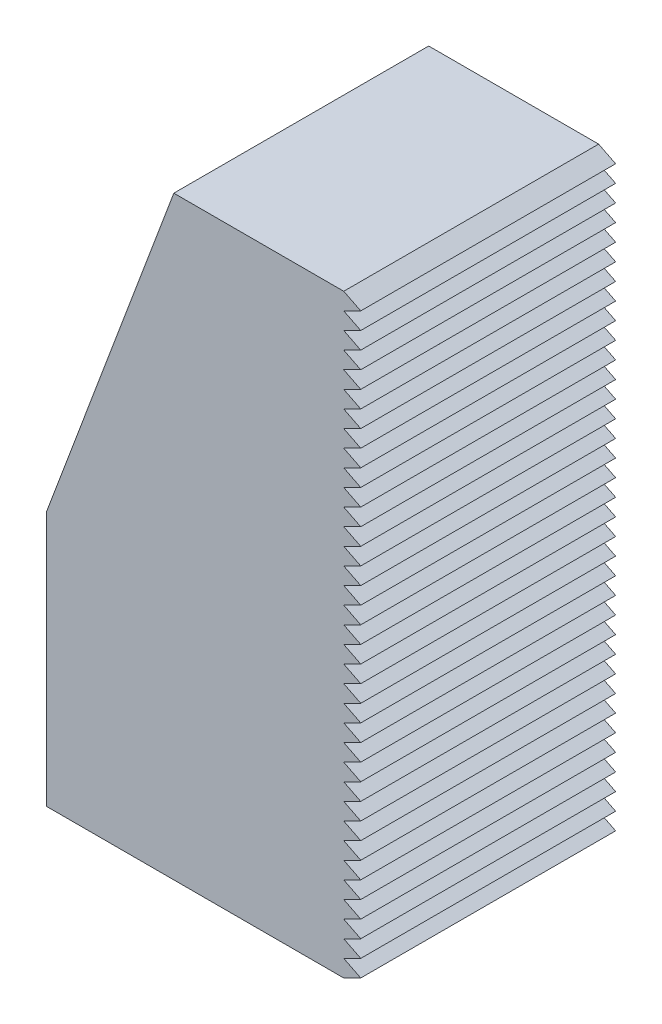
from build123d import *

# Parameters (mm, degrees)
BOSS_EXTRUDE1_DEPTH = 30
BOSS_EXTRUDE3_DEPTH = 30
LPATTERN1_COUNT     = 35
LPATTERN1_PITCH     = 2


with BuildPart() as part:
    # Sketch2 → Boss-Extrude1 (new body)
    with BuildSketch(Plane.XY):
        Polygon((-35, 30), (-20, 70), (0, 70), (0, 0), (-35, 0), align=None)
    extrude(amount=BOSS_EXTRUDE1_DEPTH)

    # Sketch3 → Boss-Extrude3 (add)
    with BuildSketch(Plane.XY.offset(30)):
        Polygon((0, 70), (2, 69), (0, 68), align=None)
    boss_extrude3 = extrude(amount=-BOSS_EXTRUDE3_DEPTH)

    # LPattern1: Boss-Extrude3 ×35
    with Locations(*[(0, -i * LPATTERN1_PITCH, 0) for i in range(1, LPATTERN1_COUNT)]):
        add(boss_extrude3)


solid = part.part
